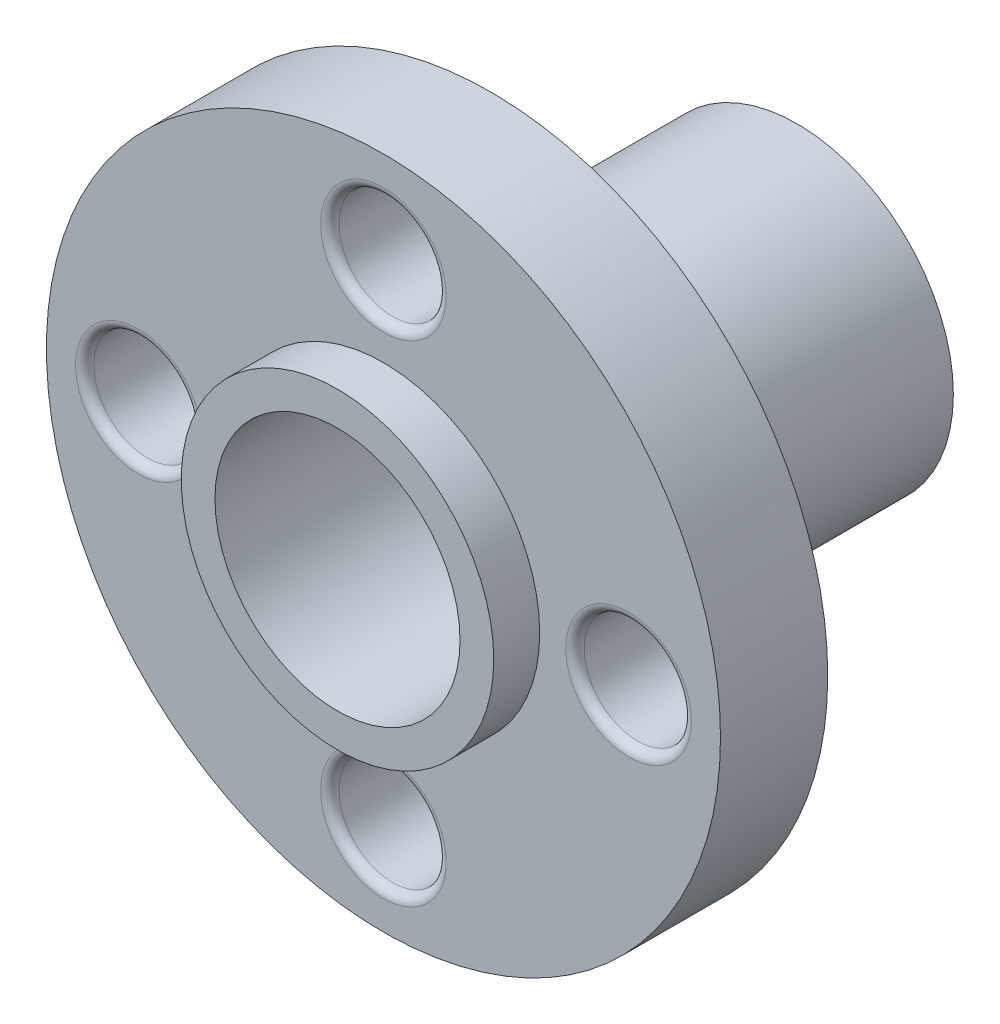
from build123d import *

# Parameters (mm, degrees)
SKETCH1_R                = 11
SKETCH1_R_2              = 5.1
SKETCH1_R_3              = 1.75
BOSS_EXTRUDE1_DEPTH      = 3.5
BOSS_EXTRUDE2_DEPTH      = 1.5
BOSS_EXTRUDE2_DEPTH_BACK = 13.5
SKETCH2_R                = 5.1
SKETCH2_R_2              = 4
FILLET2_R                = 0.3


with BuildPart() as part:
    # Sketch1 → Boss-Extrude1 (new body)
    with BuildSketch(Plane.XY):
        Circle(SKETCH1_R)
        Circle(SKETCH1_R_2, mode=Mode.SUBTRACT)
        with Locations((0, 8)):
            Circle(SKETCH1_R_3, mode=Mode.SUBTRACT)
        with Locations((8, 0)):
            Circle(SKETCH1_R_3, mode=Mode.SUBTRACT)
        with Locations((0, -8)):
            Circle(SKETCH1_R_3, mode=Mode.SUBTRACT)
        with Locations((-8, 0)):
            Circle(SKETCH1_R_3, mode=Mode.SUBTRACT)
    extrude(amount=-BOSS_EXTRUDE1_DEPTH)

    # Sketch2 → Boss-Extrude2 (add, two sides: drawn at the far end of the back side and taken through both)
    with BuildSketch(Plane.XY.offset(-BOSS_EXTRUDE2_DEPTH_BACK)):
        Circle(SKETCH2_R)
        Circle(SKETCH2_R_2, mode=Mode.SUBTRACT)
    extrude(amount=BOSS_EXTRUDE2_DEPTH + BOSS_EXTRUDE2_DEPTH_BACK)

    # Fillet2
    fillet2_edges = [part.edges().sort_by_distance(p)[0] for p in [
        (6.25, 0, 0),
        (-1.75, -8, 0),
        (-9.75, 0, 0),
        (-1.75, 8, 0),
    ]]
    fillet(fillet2_edges, radius=FILLET2_R)


solid = part.part
